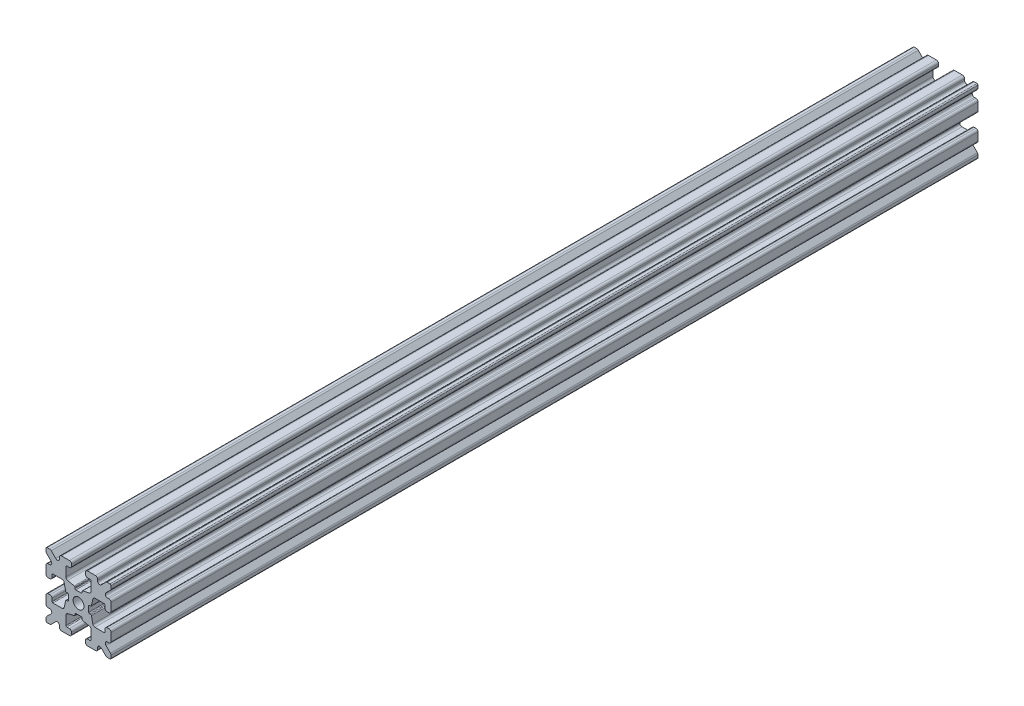
from build123d import *

# Parameters (mm, degrees)
SKETCH1_W           = 15
SKETCH1_H           = 15
SKETCH1_R           = 1.25
BOSS_EXTRUDE1_DEPTH = 100
FILLET1_R           = 0.25
CUT_EXTRUDE1_DEPTH  = 201.281052524
CUT_EXTRUDE3_DEPTH  = 201.281052524
FILLET3_R           = 0.5
FILLET4_R           = 0.5
FILLET5_R           = 3
FILLET6_R           = 0.2
CUT_EXTRUDE4_DEPTH  = 201.281052524
FILLET8_R           = 0.5
SKETCH6_W           = 5.1529354
SKETCH6_H           = 1.651
SKETCH6_W_2         = 1.651
SKETCH6_H_2         = 5.1529354
CUT_EXTRUDE5_DEPTH  = 201.281052524
FILLET10_R          = 0.2


with BuildPart() as part:
    # Sketch1 → Boss-Extrude1 (new, symmetric)
    with BuildSketch(Plane.XY):
        Rectangle(SKETCH1_W, SKETCH1_H)
        Circle(SKETCH1_R, mode=Mode.SUBTRACT)
    extrude(amount=BOSS_EXTRUDE1_DEPTH, both=True)

    # Fillet1
    fillet1_edges = [part.edges().sort_by_distance(p)[0] for p in [
        (7.5, -7.5, 0),
        (-7.5, -7.5, 0),
        (-7.5, 7.5, 0),
        (7.5, 7.5, 0),
    ]]
    fillet(fillet1_edges, radius=FILLET1_R)

    # Sketch2 → Cut-Extrude1 (cut, through all)
    with BuildSketch(Plane.XY.offset(100)):
        Polygon((-7.5, 1.6), (-6.1, 1.6), (-6.1, 2.9), (-3.4, 2.9), (-3.4, -2.9), (-6.1, -2.9), (-6.1, -1.6), (-7.5, -1.6), align=None)
        Polygon((2.9, 6.1), (1.6, 6.1), (1.6, 7.5), (-1.6, 7.5), (-1.6, 6.1), (-2.9, 6.1), (-2.9, 3.4), (2.9, 3.4), align=None)
        Polygon((-1.6, -7.5), (-1.6, -6.1), (-2.9, -6.1), (-2.9, -3.4), (2.9, -3.4), (2.9, -6.1), (1.6, -6.1), (1.6, -7.5), align=None)
        Polygon((6.1, -2.9), (6.1, -1.6), (7.5, -1.6), (7.5, 1.6), (6.1, 1.6), (6.1, 2.9), (3.4, 2.9), (3.4, -2.9), align=None)
    extrude(amount=-CUT_EXTRUDE1_DEPTH, mode=Mode.SUBTRACT)

    # Sketch4 → Cut-Extrude3 (cut, through all)
    with BuildSketch(Plane.XY.offset(100)):
        Polygon((-3.4, 2.9), (-2.75, 0), (-3.4, -2.9), align=None)
        Polygon((-2.9, 3.4), (0, 2.75), (2.9, 3.4), align=None)
        Polygon((3.4, 2.9), (2.75, 0), (3.4, -2.9), align=None)
        Polygon((-2.9, -3.4), (0, -2.75), (2.9, -3.4), align=None)
    extrude(amount=-CUT_EXTRUDE3_DEPTH, mode=Mode.SUBTRACT)

    # Fillet3
    fillet3_edges = [part.edges().sort_by_distance(p)[0] for p in [
        (1.6, -7.5, 0),
        (-1.6, -7.5, 0),
        (-1.6, -6.1, 0),
        (1.6, -6.1, 0),
        (6.1, 1.6, 0),
        (7.5, 1.6, 0),
        (7.5, -1.6, 0),
        (6.1, -1.6, 0),
        (-7.5, -1.6, 0),
        (-7.5, 1.6, 0),
        (-6.1, 1.6, 0),
        (-6.1, -1.6, 0),
        (-1.6, 6.1, 0),
        (-1.6, 7.5, 0),
        (1.6, 7.5, 0),
        (1.6, 6.1, 0),
    ]]
    fillet(fillet3_edges, radius=FILLET3_R)

    # Fillet4
    fillet4_edges = [part.edges().sort_by_distance(p)[0] for p in [
        (-2.9, -3.4, 0),
        (2.9, -3.4, 0),
        (3.4, -2.9, 0),
        (3.4, 2.9, 0),
        (-3.4, 2.9, 0),
        (-3.4, -2.9, 0),
        (2.9, 3.4, 0),
        (-2.9, 3.4, 0),
    ]]
    fillet(fillet4_edges, radius=FILLET4_R)

    # Fillet5
    fillet5_edges = [part.edges().sort_by_distance(p)[0] for p in [
        (-2.75, 0, 0),
        (0, 2.75, 0),
        (2.75, 0, 0),
        (0, -2.75, 0),
    ]]
    fillet(fillet5_edges, radius=FILLET5_R)

    # Fillet6
    fillet6_edges = [part.edges().sort_by_distance(p)[0] for p in [
        (-2.9, -6.1, 0),
        (2.9, -6.1, 0),
        (6.1, -2.9, 0),
        (6.1, 2.9, 0),
        (-6.1, 2.9, 0),
        (-6.1, -2.9, 0),
        (2.9, 6.1, 0),
        (-2.9, 6.1, 0),
    ]]
    fillet(fillet6_edges, radius=FILLET6_R)

    # Sketch5 → Cut-Extrude4 (cut, through all)
    with BuildSketch(Plane.XY.offset(100)):
        Polygon((-7.5, 6.439339828), (-5.460660172, 4.4), (-7.5, 4.4), align=None)
        Polygon((-6.439339828, 7.5), (-4.4, 5.460660172), (-4.4, 7.5), align=None)
        Polygon((4.4, 7.5), (6.439339828, 7.5), (4.4, 5.460660172), align=None)
        Polygon((7.5, 6.439339828), (7.5, 4.4), (5.460660172, 4.4), align=None)
        Polygon((7.5, -6.439339828), (5.460660172, -4.4), (7.5, -4.4), align=None)
        Polygon((6.439339828, -7.5), (4.4, -5.460660172), (4.4, -7.5), align=None)
        Polygon((-4.4, -7.5), (-6.439339828, -7.5), (-4.4, -5.460660172), align=None)
        Polygon((-7.5, -6.439339828), (-7.5, -4.4), (-5.460660172, -4.4), align=None)
    extrude(amount=-CUT_EXTRUDE4_DEPTH, mode=Mode.SUBTRACT)

    # Fillet8
    fillet8_edges = [part.edges().sort_by_distance(p)[0] for p in [
        (-7.5, 4.4, 0),
        (-7.5, 6.439339828, 0),
        (-5.460660172, 4.4, 0),
        (7.5, -4.4, 0),
        (7.5, -6.439339828, 0),
        (5.460660172, -4.4, 0),
        (5.460660172, 4.4, 0),
        (7.5, 6.439339828, 0),
        (7.5, 4.4, 0),
        (-4.4, 7.5, 0),
        (-4.4, 5.460660172, 0),
        (-6.439339828, 7.5, 0),
        (-5.460660172, -4.4, 0),
        (-7.5, -6.439339828, 0),
        (-7.5, -4.4, 0),
        (4.4, 5.460660172, 0),
        (4.4, 7.5, 0),
        (6.439339828, 7.5, 0),
        (6.439339828, -7.5, 0),
        (4.4, -7.5, 0),
        (4.4, -5.460660172, 0),
        (-6.439339828, -7.5, 0),
        (-4.4, -5.460660172, 0),
        (-4.4, -7.5, 0),
    ]]
    fillet(fillet8_edges, radius=FILLET8_R)

    # Sketch6 → Cut-Extrude5 (cut, through all)
    with BuildSketch(Plane.XY.offset(100)):
        with Locations((4.9235323, 0)):
            Rectangle(SKETCH6_W, SKETCH6_H)
        with Locations((0, -4.9235323)):
            Rectangle(SKETCH6_W_2, SKETCH6_H_2)
        with Locations((-4.9235323, 0)):
            Rectangle(SKETCH6_W, SKETCH6_H)
        with Locations((0, 4.9235323)):
            Rectangle(SKETCH6_W_2, SKETCH6_H_2)
    extrude(amount=-CUT_EXTRUDE5_DEPTH, mode=Mode.SUBTRACT)

    # Fillet10
    fillet10_edges = [part.edges().sort_by_distance(p)[0] for p in [
        (0.8255, -2.935025862, 0),
        (-0.8255, -2.935025862, 0),
        (0.8255, -2.3470646, 0),
        (-0.8255, -2.3470646, 0),
        (2.935025862, 0.8255, 0),
        (2.935025862, -0.8255, 0),
        (2.3470646, 0.8255, 0),
        (2.3470646, -0.8255, 0),
        (-2.935025862, -0.8255, 0),
        (-2.935025862, 0.8255, 0),
        (-2.3470646, -0.8255, 0),
        (-2.3470646, 0.8255, 0),
        (-0.8255, 2.935025862, 0),
        (0.8255, 2.935025862, 0),
        (-0.8255, 2.3470646, 0),
        (0.8255, 2.3470646, 0),
    ]]
    fillet(fillet10_edges, radius=FILLET10_R)


solid = part.part
